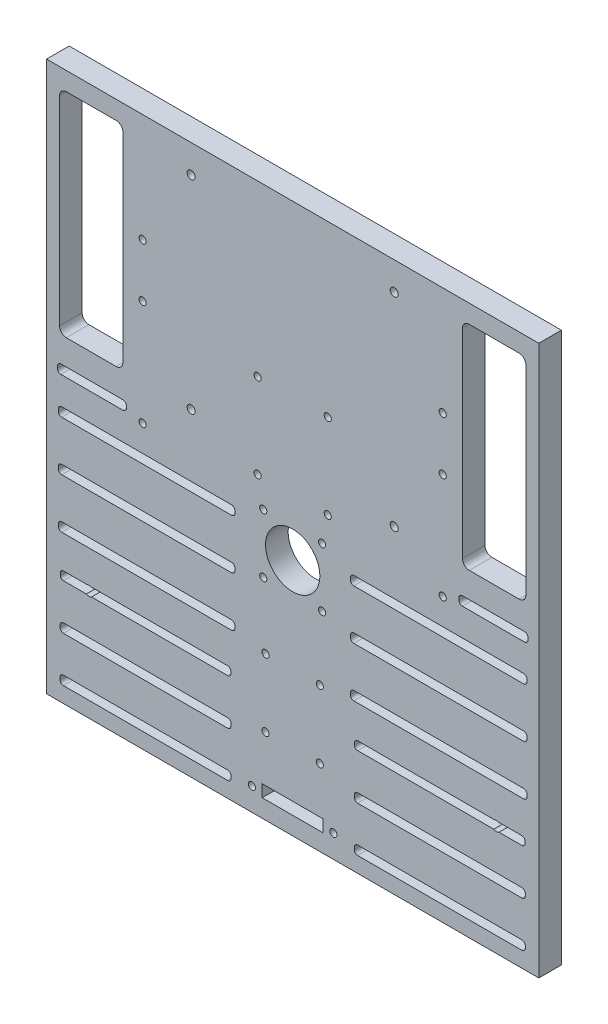
from build123d import *

# Parameters (mm, degrees)
MODEL_W             = 217.45
MODEL_H             = 242.848214609
MODEL_R             = 12
MODEL_R_2           = 1.575
MODEL_R_3           = 1.775
MODEL_W_2           = 26.927250668
MODEL_H_2           = 5.356881787
BOSS_EXTRUDE1_DEPTH = 10


with BuildPart() as part:
    # Model → Boss-Extrude1 (new body)
    with BuildSketch(Plane.XY):
        with Locations((-65.266187111, 33.085004396)):
            Rectangle(MODEL_W, MODEL_H)
        with Locations((-65.266187111, 17.079944497)):
            Circle(MODEL_R, mode=Mode.SUBTRACT)
        with Locations((-83.266187111, -78.214102909)):
            Circle(MODEL_R_2, mode=Mode.SUBTRACT)
        with Locations((-47.266187111, -78.214102909)):
            Circle(MODEL_R_2, mode=Mode.SUBTRACT)
        with Locations((-53.266187111, -54.634898886)):
            Circle(MODEL_R_2, mode=Mode.SUBTRACT)
        with Locations((-77.266187111, -54.634898886)):
            Circle(MODEL_R_2, mode=Mode.SUBTRACT)
        with Locations((-77.266187111, -24.634898886)):
            Circle(MODEL_R_2, mode=Mode.SUBTRACT)
        with Locations((-53.266187111, -24.634898886)):
            Circle(MODEL_R_2, mode=Mode.SUBTRACT)
        with Locations((-52.266187111, 4.079944497)):
            Circle(MODEL_R_2, mode=Mode.SUBTRACT)
        with Locations((-78.266187111, 4.079944497)):
            Circle(MODEL_R_2, mode=Mode.SUBTRACT)
        with Locations((-78.266187111, 30.079944497)):
            Circle(MODEL_R_2, mode=Mode.SUBTRACT)
        with Locations((-52.266187111, 30.079944497)):
            Circle(MODEL_R_2, mode=Mode.SUBTRACT)
        with Locations((-49.780313009, 42.21938946)):
            Circle(MODEL_R_2, mode=Mode.SUBTRACT)
        with Locations((-80.752061213, 42.21938946)):
            Circle(MODEL_R_2, mode=Mode.SUBTRACT)
        with Locations((-131.546259235, 36.397683325)):
            Circle(MODEL_R_2, mode=Mode.SUBTRACT)
        with Locations((1.013885014, 36.397683325)):
            Circle(MODEL_R_2, mode=Mode.SUBTRACT)
        with Locations((-110.116187111, 52.429944497)):
            Circle(MODEL_R_3, mode=Mode.SUBTRACT)
        with Locations((-20.416187111, 52.429944497)):
            Circle(MODEL_R_3, mode=Mode.SUBTRACT)
        with Locations((-49.780313009, 79.62237987)):
            Circle(MODEL_R_2, mode=Mode.SUBTRACT)
        with Locations((-80.752061213, 79.62237987)):
            Circle(MODEL_R_2, mode=Mode.SUBTRACT)
        with Locations((-131.546259235, 83.109800249)):
            Circle(MODEL_R_2, mode=Mode.SUBTRACT)
        with Locations((1.013885014, 83.109800249)):
            Circle(MODEL_R_2, mode=Mode.SUBTRACT)
        with Locations((1.013885014, 106.617187947)):
            Circle(MODEL_R_2, mode=Mode.SUBTRACT)
        with Locations((-20.416187111, 142.129944497)):
            Circle(MODEL_R_3, mode=Mode.SUBTRACT)
        with Locations((-110.116187111, 142.129944497)):
            Circle(MODEL_R_3, mode=Mode.SUBTRACT)
        with Locations((-131.546259235, 106.617187947)):
            Circle(MODEL_R_2, mode=Mode.SUBTRACT)
        with BuildLine():
            Line((-154.105266976, -41.349912082), (-93.977009275, -41.349912082))
            ThreePointArc((-93.977009275, -41.349912082), (-93.004737451, -40.947183906), (-92.602009275, -39.974912082))
            Line((-92.602009275, -39.974912082), (-92.602009275, -38.974912082))
            ThreePointArc((-92.602009275, -38.974912082), (-93.004737451, -38.002640258), (-93.977009275, -37.599912082))
            Line((-93.977009275, -37.599912082), (-154.469845538, -37.599912082))
            ThreePointArc((-154.469845538, -37.599912082), (-155.266187111, -37.445055503), (-156.062528683, -37.599912082))
            Line((-156.062528683, -37.599912082), (-166.527658861, -37.599912082))
            ThreePointArc((-166.527658861, -37.599912082), (-167.499930685, -38.002640258), (-167.902658861, -38.974912082))
            Line((-167.902658861, -38.974912082), (-167.902658861, -39.974912082))
            ThreePointArc((-167.902658861, -39.974912082), (-167.499930685, -40.947183906), (-166.527658861, -41.349912082))
            Line((-166.527658861, -41.349912082), (-156.427107245, -41.349912082))
            ThreePointArc((-156.427107245, -41.349912082), (-155.266187111, -41.695055503), (-154.105266976, -41.349912082))
        make_face(mode=Mode.SUBTRACT)
        with BuildLine():
            Line((37.495284639, -59.974912082), (37.495284639, -58.974912082))
            ThreePointArc((37.495284639, -58.974912082), (37.055944811, -57.91425191), (35.995284639, -57.474912082))
            Line((35.995284639, -57.474912082), (-36.555364947, -57.474912082))
            ThreePointArc((-36.555364947, -57.474912082), (-37.616025119, -57.91425191), (-38.055364947, -58.974912082))
            Line((-38.055364947, -58.974912082), (-38.055364947, -59.974912082))
            ThreePointArc((-38.055364947, -59.974912082), (-37.616025119, -61.035572254), (-36.555364947, -61.474912082))
            Line((-36.555364947, -61.474912082), (35.995284639, -61.474912082))
            ThreePointArc((35.995284639, -61.474912082), (37.055944811, -61.035572254), (37.495284639, -59.974912082))
        make_face(mode=Mode.SUBTRACT)
        with BuildLine():
            Line((-90.770296951, -21.663770203), (-90.770296951, -20.663770203))
            ThreePointArc((-90.770296951, -20.663770203), (-91.209636779, -19.603110031), (-92.270296951, -19.163770203))
            Line((-92.270296951, -19.163770203), (-167.284223867, -19.163770203))
            ThreePointArc((-167.284223867, -19.163770203), (-168.344884038, -19.603110031), (-168.784223867, -20.663770203))
            Line((-168.784223867, -20.663770203), (-168.784223867, -21.663770203))
            ThreePointArc((-168.784223867, -21.663770203), (-168.344884038, -22.724430374), (-167.284223867, -23.163770203))
            Line((-167.284223867, -23.163770203), (-92.270296951, -23.163770203))
            ThreePointArc((-92.270296951, -23.163770203), (-91.209636779, -22.724430374), (-90.770296951, -21.663770203))
        make_face(mode=Mode.SUBTRACT)
        with BuildLine():
            Line((-90.770296951, 22.336229797), (-90.770296951, 23.336229797))
            ThreePointArc((-90.770296951, 23.336229797), (-91.209636779, 24.396889969), (-92.270296951, 24.836229797))
            Line((-92.270296951, 24.836229797), (-167.284223867, 24.836229797))
            ThreePointArc((-167.284223867, 24.836229797), (-168.344884038, 24.396889969), (-168.784223867, 23.336229797))
            Line((-168.784223867, 23.336229797), (-168.784223867, 22.336229797))
            ThreePointArc((-168.784223867, 22.336229797), (-168.344884038, 21.275569626), (-167.284223867, 20.836229797))
            Line((-167.284223867, 20.836229797), (-92.270296951, 20.836229797))
            ThreePointArc((-92.270296951, 20.836229797), (-91.209636779, 21.275569626), (-90.770296951, 22.336229797))
        make_face(mode=Mode.SUBTRACT)
        with BuildLine():
            Line((-90.770296951, 0.336229797), (-90.770296951, 1.336229797))
            ThreePointArc((-90.770296951, 1.336229797), (-91.209636779, 2.396889969), (-92.270296951, 2.836229797))
            Line((-92.270296951, 2.836229797), (-167.284223867, 2.836229797))
            ThreePointArc((-167.284223867, 2.836229797), (-168.344884038, 2.396889969), (-168.784223867, 1.336229797))
            Line((-168.784223867, 1.336229797), (-168.784223867, 0.336229797))
            ThreePointArc((-168.784223867, 0.336229797), (-168.344884038, -0.724430374), (-167.284223867, -1.163770203))
            Line((-167.284223867, -1.163770203), (-92.270296951, -1.163770203))
            ThreePointArc((-92.270296951, -1.163770203), (-91.209636779, -0.724430374), (-90.770296951, 0.336229797))
        make_face(mode=Mode.SUBTRACT)
        with BuildLine():
            Line((37.495284639, -79.974912082), (37.495284639, -78.974912082))
            ThreePointArc((37.495284639, -78.974912082), (37.055944811, -77.91425191), (35.995284639, -77.474912082))
            Line((35.995284639, -77.474912082), (-36.555364947, -77.474912082))
            ThreePointArc((-36.555364947, -77.474912082), (-37.616025119, -77.91425191), (-38.055364947, -78.974912082))
            Line((-38.055364947, -78.974912082), (-38.055364947, -79.974912082))
            ThreePointArc((-38.055364947, -79.974912082), (-37.616025119, -81.035572254), (-36.555364947, -81.474912082))
            Line((-36.555364947, -81.474912082), (35.995284639, -81.474912082))
            ThreePointArc((35.995284639, -81.474912082), (37.055944811, -81.035572254), (37.495284639, -79.974912082))
        make_face(mode=Mode.SUBTRACT)
        with BuildLine():
            Line((-92.477009275, -59.974912082), (-92.477009275, -58.974912082))
            ThreePointArc((-92.477009275, -58.974912082), (-92.916349103, -57.91425191), (-93.977009275, -57.474912082))
            Line((-93.977009275, -57.474912082), (-166.527658861, -57.474912082))
            ThreePointArc((-166.527658861, -57.474912082), (-167.588319033, -57.91425191), (-168.027658861, -58.974912082))
            Line((-168.027658861, -58.974912082), (-168.027658861, -59.974912082))
            ThreePointArc((-168.027658861, -59.974912082), (-167.588319033, -61.035572254), (-166.527658861, -61.474912082))
            Line((-166.527658861, -61.474912082), (-93.977009275, -61.474912082))
            ThreePointArc((-93.977009275, -61.474912082), (-92.916349103, -61.035572254), (-92.477009275, -59.974912082))
        make_face(mode=Mode.SUBTRACT)
        with BuildLine():
            Line((-92.477009275, -79.974912082), (-92.477009275, -78.974912082))
            ThreePointArc((-92.477009275, -78.974912082), (-92.916349103, -77.91425191), (-93.977009275, -77.474912082))
            Line((-93.977009275, -77.474912082), (-166.527658861, -77.474912082))
            ThreePointArc((-166.527658861, -77.474912082), (-167.588319033, -77.91425191), (-168.027658861, -78.974912082))
            Line((-168.027658861, -78.974912082), (-168.027658861, -79.974912082))
            ThreePointArc((-168.027658861, -79.974912082), (-167.588319033, -81.035572254), (-166.527658861, -81.474912082))
            Line((-166.527658861, -81.474912082), (-93.977009275, -81.474912082))
            ThreePointArc((-93.977009275, -81.474912082), (-92.916349103, -81.035572254), (-92.477009275, -79.974912082))
        make_face(mode=Mode.SUBTRACT)
        with BuildLine():
            Line((9.684622202, 37.035820187), (37.163382146, 37.035820187))
            ThreePointArc((37.163382146, 37.035820187), (38.224042318, 37.475160015), (38.663382146, 38.535820187))
            Line((38.663382146, 38.535820187), (38.663382146, 39.535820187))
            ThreePointArc((38.663382146, 39.535820187), (38.224042318, 40.596480358), (37.163382146, 41.035820187))
            Line((37.163382146, 41.035820187), (9.684622202, 41.035820187))
            ThreePointArc((9.684622202, 41.035820187), (8.62396203, 40.596480358), (8.184622202, 39.535820187))
            Line((8.184622202, 39.535820187), (8.184622202, 38.535820187))
            ThreePointArc((8.184622202, 38.535820187), (8.62396203, 37.475160015), (9.684622202, 37.035820187))
        make_face(mode=Mode.SUBTRACT)
        with BuildLine():
            Line((-138.716996423, 38.535820187), (-138.716996423, 39.535820187))
            ThreePointArc((-138.716996423, 39.535820187), (-139.156336251, 40.596480358), (-140.216996423, 41.035820187))
            Line((-140.216996423, 41.035820187), (-167.695756368, 41.035820187))
            ThreePointArc((-167.695756368, 41.035820187), (-168.75641654, 40.596480358), (-169.195756368, 39.535820187))
            Line((-169.195756368, 39.535820187), (-169.195756368, 38.535820187))
            ThreePointArc((-169.195756368, 38.535820187), (-168.75641654, 37.475160015), (-167.695756368, 37.035820187))
            Line((-167.695756368, 37.035820187), (-140.216996423, 37.035820187))
            ThreePointArc((-140.216996423, 37.035820187), (-139.156336251, 37.475160015), (-138.716996423, 38.535820187))
        make_face(mode=Mode.SUBTRACT)
        with BuildLine():
            Line((38.251849645, 22.336229797), (38.251849645, 23.336229797))
            ThreePointArc((38.251849645, 23.336229797), (37.812509817, 24.396889969), (36.751849645, 24.836229797))
            Line((36.751849645, 24.836229797), (-38.262077271, 24.836229797))
            ThreePointArc((-38.262077271, 24.836229797), (-39.322737442, 24.396889969), (-39.762077271, 23.336229797))
            Line((-39.762077271, 23.336229797), (-39.762077271, 22.336229797))
            ThreePointArc((-39.762077271, 22.336229797), (-39.322737442, 21.275569626), (-38.262077271, 20.836229797))
            Line((-38.262077271, 20.836229797), (36.751849645, 20.836229797))
            ThreePointArc((36.751849645, 20.836229797), (37.812509817, 21.275569626), (38.251849645, 22.336229797))
        make_face(mode=Mode.SUBTRACT)
        with BuildLine():
            Line((-38.262077271, -1.163770203), (36.751849645, -1.163770203))
            ThreePointArc((36.751849645, -1.163770203), (37.812509817, -0.724430374), (38.251849645, 0.336229797))
            Line((38.251849645, 0.336229797), (38.251849645, 1.336229797))
            ThreePointArc((38.251849645, 1.336229797), (37.812509817, 2.396889969), (36.751849645, 2.836229797))
            Line((36.751849645, 2.836229797), (-38.262077271, 2.836229797))
            ThreePointArc((-38.262077271, 2.836229797), (-39.322737442, 2.396889969), (-39.762077271, 1.336229797))
            Line((-39.762077271, 1.336229797), (-39.762077271, 0.336229797))
            ThreePointArc((-39.762077271, 0.336229797), (-39.322737442, -0.724430374), (-38.262077271, -1.163770203))
        make_face(mode=Mode.SUBTRACT)
        with BuildLine():
            Line((-38.262077271, -23.163770203), (36.751849645, -23.163770203))
            ThreePointArc((36.751849645, -23.163770203), (37.812509817, -22.724430374), (38.251849645, -21.663770203))
            Line((38.251849645, -21.663770203), (38.251849645, -20.663770203))
            ThreePointArc((38.251849645, -20.663770203), (37.812509817, -19.603110031), (36.751849645, -19.163770203))
            Line((36.751849645, -19.163770203), (-38.262077271, -19.163770203))
            ThreePointArc((-38.262077271, -19.163770203), (-39.322737442, -19.603110031), (-39.762077271, -20.663770203))
            Line((-39.762077271, -20.663770203), (-39.762077271, -21.663770203))
            ThreePointArc((-39.762077271, -21.663770203), (-39.322737442, -22.724430374), (-38.262077271, -23.163770203))
        make_face(mode=Mode.SUBTRACT)
        with BuildLine():
            Line((9.733812889, 143.3841117), (9.733812889, 55.260255257))
            ThreePointArc((9.733812889, 55.260255257), (10.612492546, 53.138934914), (12.733812889, 52.260255257))
            Line((12.733812889, 52.260255257), (34.733812889, 52.260255257))
            ThreePointArc((34.733812889, 52.260255257), (36.855133233, 53.138934914), (37.733812889, 55.260255257))
            Line((37.733812889, 55.260255257), (37.733812889, 143.3841117))
            ThreePointArc((37.733812889, 143.3841117), (36.855133233, 145.505432044), (34.733812889, 146.3841117))
            Line((34.733812889, 146.3841117), (12.733812889, 146.3841117))
            ThreePointArc((12.733812889, 146.3841117), (10.612492546, 145.505432044), (9.733812889, 143.3841117))
        make_face(mode=Mode.SUBTRACT)
        with BuildLine():
            Line((-165.266187111, 52.260255257), (-143.266187111, 52.260255257))
            ThreePointArc((-143.266187111, 52.260255257), (-141.144866767, 53.138934914), (-140.266187111, 55.260255257))
            Line((-140.266187111, 55.260255257), (-140.266187111, 143.3841117))
            ThreePointArc((-140.266187111, 143.3841117), (-141.144866767, 145.505432044), (-143.266187111, 146.3841117))
            Line((-143.266187111, 146.3841117), (-165.266187111, 146.3841117))
            ThreePointArc((-165.266187111, 146.3841117), (-167.387507454, 145.505432044), (-168.266187111, 143.3841117))
            Line((-168.266187111, 143.3841117), (-168.266187111, 55.260255257))
            ThreePointArc((-168.266187111, 55.260255257), (-167.387507454, 53.138934914), (-165.266187111, 52.260255257))
        make_face(mode=Mode.SUBTRACT)
        with Locations((-65.266187111, -77.779311165)):
            Rectangle(MODEL_W_2, MODEL_H_2, mode=Mode.SUBTRACT)
        with BuildLine():
            Line((25.894733024, -41.349912082), (35.995284639, -41.349912082))
            ThreePointArc((35.995284639, -41.349912082), (36.967556463, -40.947183906), (37.370284639, -39.974912082))
            Line((37.370284639, -39.974912082), (37.370284639, -38.974912082))
            ThreePointArc((37.370284639, -38.974912082), (36.967556463, -38.002640258), (35.995284639, -37.599912082))
            Line((35.995284639, -37.599912082), (25.530154462, -37.599912082))
            ThreePointArc((25.530154462, -37.599912082), (24.733812889, -37.445055503), (23.937471317, -37.599912082))
            Line((23.937471317, -37.599912082), (-36.555364947, -37.599912082))
            ThreePointArc((-36.555364947, -37.599912082), (-37.527636771, -38.002640258), (-37.930364947, -38.974912082))
            Line((-37.930364947, -38.974912082), (-37.930364947, -39.974912082))
            ThreePointArc((-37.930364947, -39.974912082), (-37.527636771, -40.947183906), (-36.555364947, -41.349912082))
            Line((-36.555364947, -41.349912082), (23.572892755, -41.349912082))
            ThreePointArc((23.572892755, -41.349912082), (24.733812889, -41.695055503), (25.894733024, -41.349912082))
        make_face(mode=Mode.SUBTRACT)
    extrude(amount=BOSS_EXTRUDE1_DEPTH)


solid = part.part
